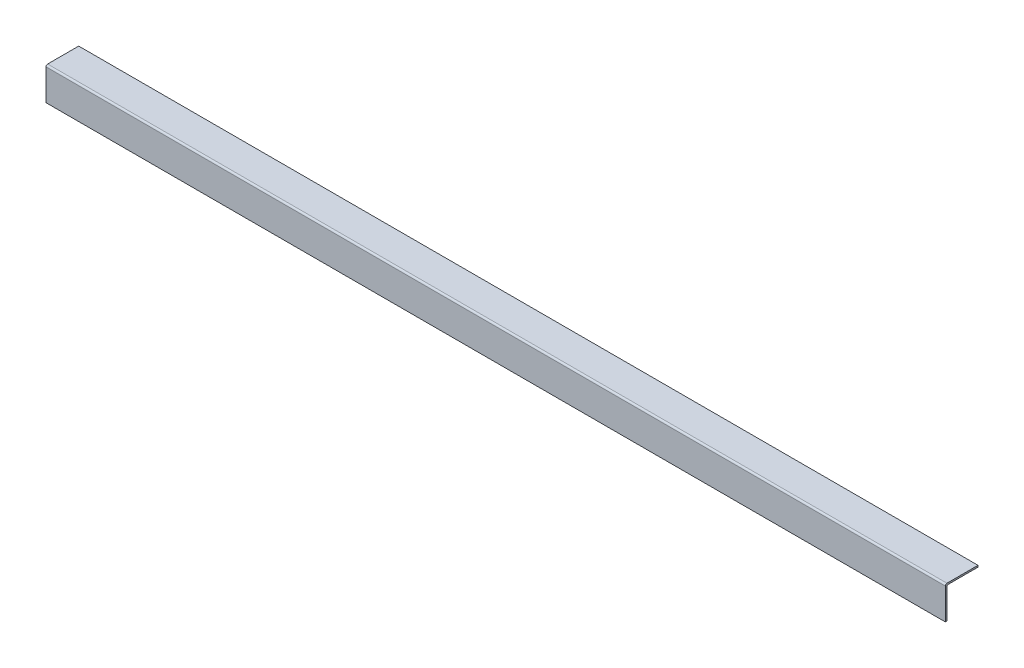
from build123d import *

# Parameters (mm, degrees)
BOSS_EXTRUDE1_DEPTH      = 137.5
BOSS_EXTRUDE1_DEPTH_BACK = 137.5


with BuildPart() as part:
    # Sketch1 → Boss-Extrude1 (new, two sides: drawn at the far end of the back side and taken through both)
    with BuildSketch(Plane(origin=(0, 0, 0), x_dir=(0, 0, -1), z_dir=(1, 0, 0)).offset(-BOSS_EXTRUDE1_DEPTH_BACK)):
        with BuildLine():
            Line((0, -10), (0, -0.5))
            ThreePointArc((0, -0.5), (0.146446609, -0.146446609), (0.5, 0))
            Line((0.5, 0), (10, 0))
            Line((10, 0), (10, -0.5))
            Line((10, -0.5), (1, -0.5))
            ThreePointArc((1, -0.5), (0.646446609, -0.646446609), (0.5, -1))
            Line((0.5, -1), (0.5, -10))
            Line((0.5, -10), (0, -10))
        make_face()
    extrude(amount=BOSS_EXTRUDE1_DEPTH + BOSS_EXTRUDE1_DEPTH_BACK)


solid = part.part
